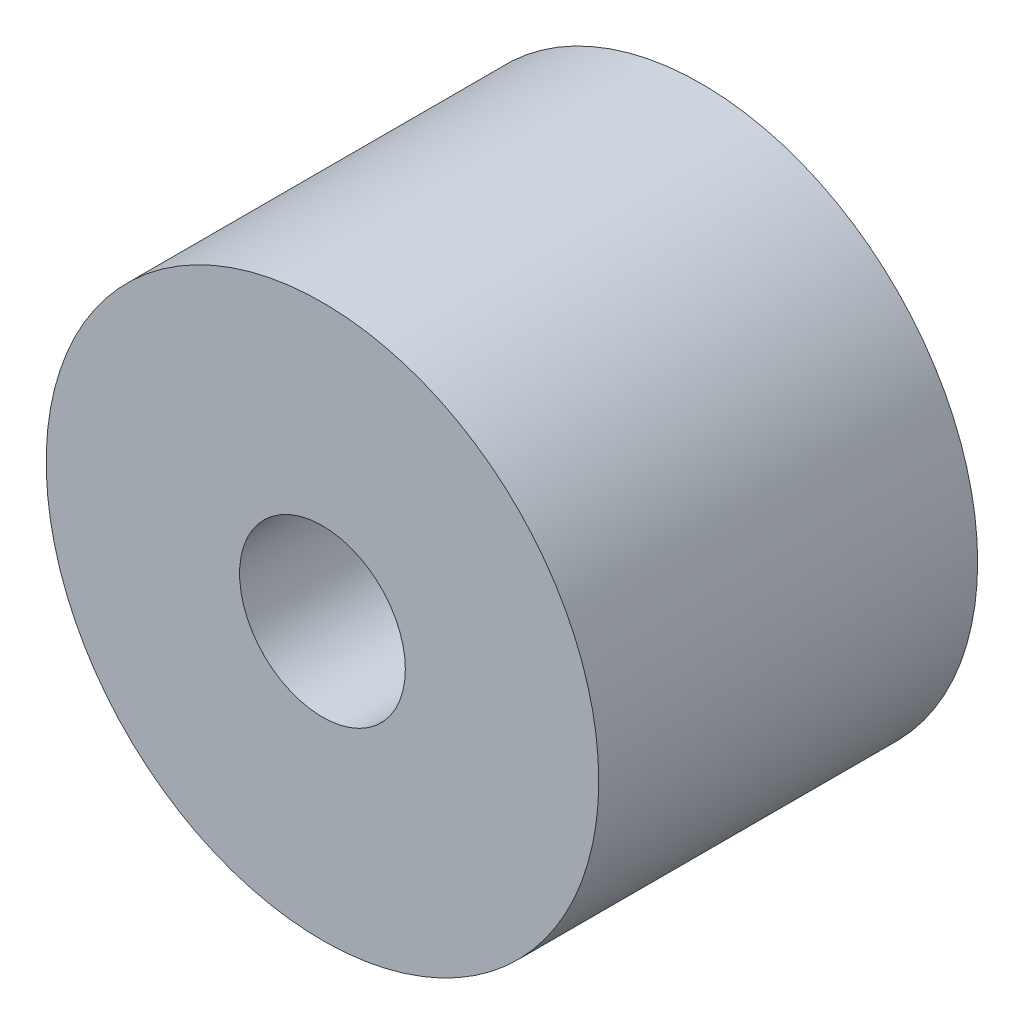
from build123d import *

# Parameters (mm, degrees)
SKETCH_1_R      = 17.5
SKETCH_1_R_2    = 5.25
EXTRUDE_1_DEPTH = 24


with BuildPart() as part:
    # Эскиз1 → Вытянуть1 (new body)
    with BuildSketch(Plane.XY):
        Circle(SKETCH_1_R)
        Circle(SKETCH_1_R_2, mode=Mode.SUBTRACT)
    extrude(amount=EXTRUDE_1_DEPTH)


solid = part.part
